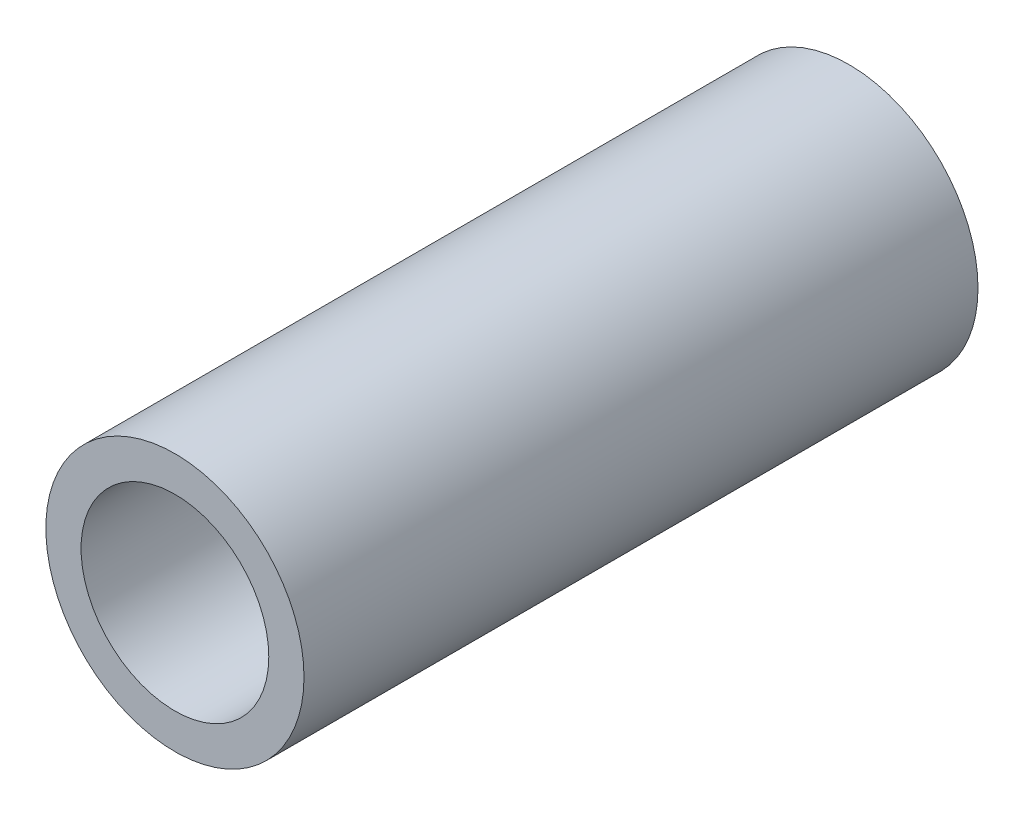
from build123d import *

# Parameters (mm, degrees)
SKETCH1_R           = 34.925
SKETCH1_R_2         = 25.4
BOSS_EXTRUDE1_DEPTH = 182.372


with BuildPart() as part:
    # Sketch1 → Boss-Extrude1 (new body)
    with BuildSketch(Plane.XY):
        Circle(SKETCH1_R)
        Circle(SKETCH1_R_2, mode=Mode.SUBTRACT)
    extrude(amount=BOSS_EXTRUDE1_DEPTH)


solid = part.part
